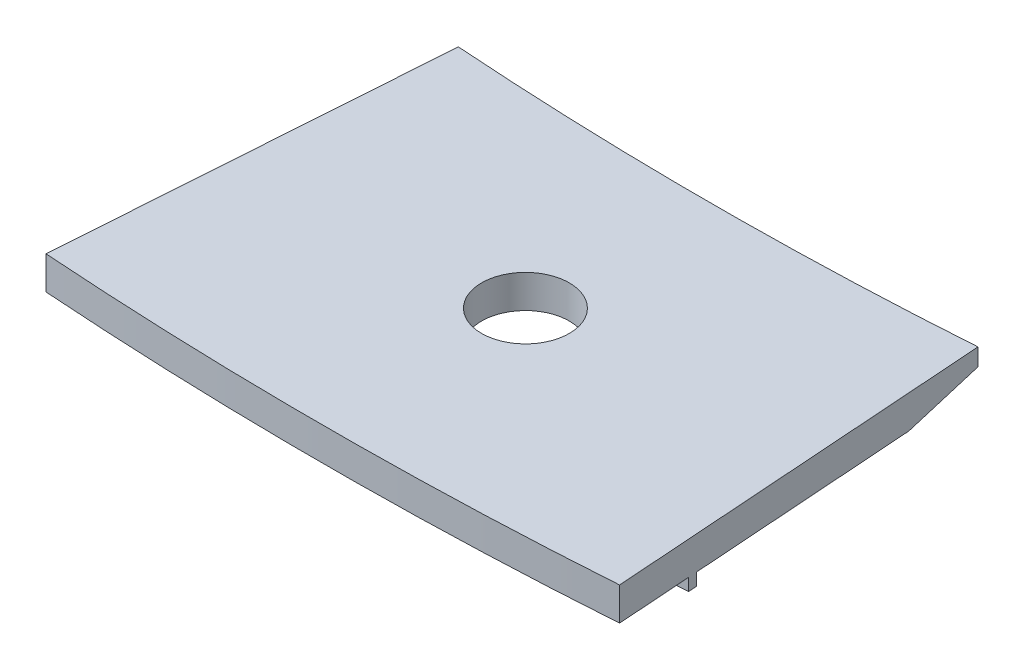
from build123d import *

# Parameters (mm, degrees)
SKETCH2_R           = 2.65
BOSS_EXTRUDE1_DEPTH = 2
BOSS_EXTRUDE2_DEPTH = 2
CHAMFER1_SIZE       = 4.5
CHAMFER1_SIZE2      = 0.956504528
BOSS_EXTRUDE3_DEPTH = 0.75


with BuildPart() as part:
    # Sketch2 → Boss-Extrude1 (new body)
    with BuildSketch(Plane(origin=(0, 0, 0), x_dir=(1, 0, 0), z_dir=(0, 1, 0))):
        with BuildLine():
            Line((-15.984695958, -228.591802117), (-17.334483725, -247.89466649))
            ThreePointArc((-17.334483725, -247.89466649), (0, -248.5), (17.334483725, -247.89466649))
            Line((17.334483725, -247.89466649), (15.984695958, -228.591802117))
            ThreePointArc((15.984695958, -228.591802117), (0, -229.15), (-15.984695958, -228.591802117))
        make_face()
        with Locations(Location((0, -236.25, 0), (0, 0, 270))):
            Circle(SKETCH2_R, mode=Mode.SUBTRACT)
    extrude(amount=BOSS_EXTRUDE1_DEPTH)

    # Sketch3 → Boss-Extrude2 (add)
    with BuildSketch(Plane(origin=(0, 0, 0), x_dir=(1, 0, 0), z_dir=(0, 1, 0))):
        with BuildLine():
            Line((-15.705670063, -224.601545916), (-15.984695958, -228.591802117))
            ThreePointArc((-15.984695958, -228.591802117), (0, -229.15), (15.984695958, -228.591802117))
            Line((15.984695958, -228.591802117), (15.705670063, -224.601545916))
            ThreePointArc((15.705670063, -224.601545916), (0, -225.15), (-15.705670063, -224.601545916))
        make_face()
    extrude(amount=BOSS_EXTRUDE2_DEPTH)

    # Chamfer1
    chamfer1_edges = [part.edges().sort_by_distance(p)[0] for p in [
        (0, 0, 225.15),
    ]]
    chamfer1_side = [part.faces().sort_by_distance(p)[0] for p in [
        (0, 0, 248.078921217),
    ]]
    chamfer(chamfer1_edges, length=CHAMFER1_SIZE, length2=CHAMFER1_SIZE2, reference=chamfer1_side[0])

    # Sketch4 → Boss-Extrude3 (add)
    with BuildSketch(Plane.XZ):
        with BuildLine():
            Line((-17.020664763, 243.406846238), (-16.985701357, 242.906846238))
            ThreePointArc((-16.985701357, 242.906846238), (0, 243.5), (16.985701357, 242.906846238))
            Line((16.985701357, 242.906846238), (17.020664763, 243.406846238))
            ThreePointArc((17.020664763, 243.406846238), (0, 244.001220949), (-17.020664763, 243.406846238))
        make_face()
    extrude(amount=BOSS_EXTRUDE3_DEPTH)


solid = part.part
